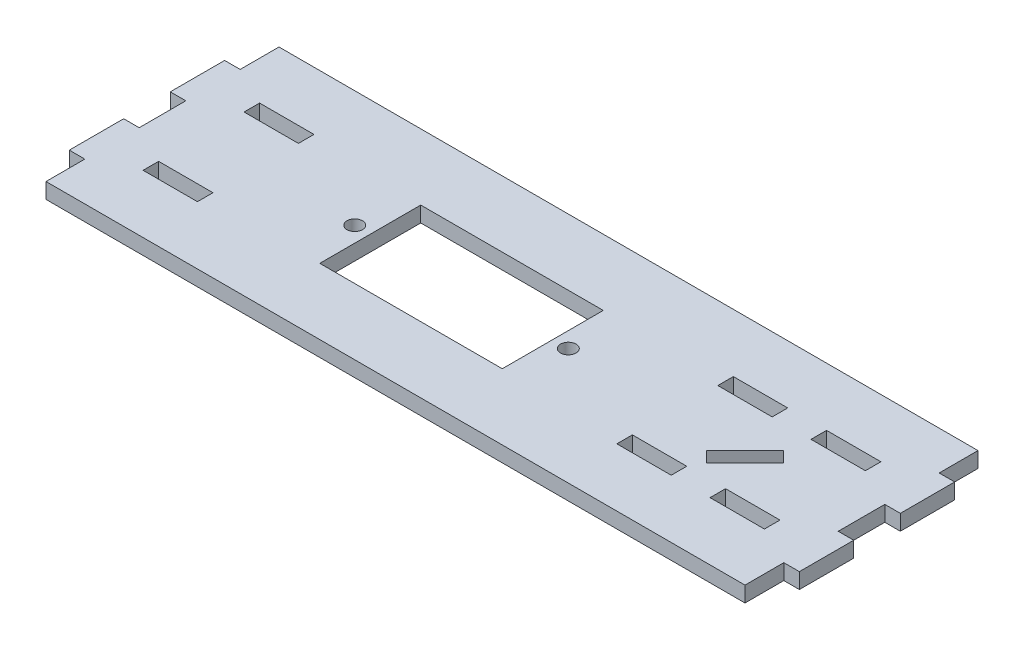
from build123d import *

# Parameters (mm, degrees)
SKETCH1_W           = 7
SKETCH1_H           = 2
SKETCH1_R           = 1
SKETCH1_W_2         = 23.5
SKETCH1_H_2         = 13
BOSS_EXTRUDE1_DEPTH = 2


with BuildPart() as part:
    # Sketch1 → Boss-Extrude1 (new body)
    with BuildSketch(Plane(origin=(0, 0, 0), x_dir=(1, 0, 0), z_dir=(0, 1, 0))):
        Polygon((66.949898611, 13.823848353), (-23.050101389, 13.823848353), (-23.050101389, 8.823848353), (-25.050101389, 8.823848353), (-25.050101389, 1.823848353), (-23.050101389, 1.823848353), (-23.050101389, -4.176151647), (-25.050101389, -4.176151647), (-25.050101389, -11.176151647), (-23.050101389, -11.176151647), (-23.050101389, -16.176151647), (66.949898611, -16.176151647), (66.949898611, -11.176151647), (68.949898611, -11.176151647), (68.949898611, -4.176151647), (66.949898611, -4.176151647), (66.949898611, 1.823848353), (68.949898611, 1.823848353), (68.949898611, 8.823848353), (66.949898611, 8.823848353), align=None)
        with Locations((-14.550101389, -7.676151647)):
            Rectangle(SKETCH1_W, SKETCH1_H, mode=Mode.SUBTRACT)
        with Locations(Location((1.699898611, -1.176151647, 0), (0, 0, 270))):
            Circle(SKETCH1_R, mode=Mode.SUBTRACT)
        with Locations((15.449898611, -1.176151647)):
            Rectangle(SKETCH1_W_2, SKETCH1_H_2, mode=Mode.SUBTRACT)
        with Locations(Location((29.199898611, -1.176151647, 0), (0, 0, 270))):
            Circle(SKETCH1_R, mode=Mode.SUBTRACT)
        with Locations((46.449898611, -7.676151647)):
            Rectangle(SKETCH1_W, SKETCH1_H, mode=Mode.SUBTRACT)
        with Locations((58.449898611, -7.676151647)):
            Rectangle(SKETCH1_W, SKETCH1_H, mode=Mode.SUBTRACT)
        Polygon((55.839898611, -0.11430823), (50.890151142, -5.064055698), (49.47593758, -3.649842135), (54.425685048, 1.299905333), align=None, mode=Mode.SUBTRACT)
        with Locations((-14.550101389, 5.323848353)):
            Rectangle(SKETCH1_W, SKETCH1_H, mode=Mode.SUBTRACT)
        with Locations((46.449898611, 5.323848353)):
            Rectangle(SKETCH1_W, SKETCH1_H, mode=Mode.SUBTRACT)
        with Locations((58.449898611, 5.323848353)):
            Rectangle(SKETCH1_W, SKETCH1_H, mode=Mode.SUBTRACT)
    extrude(amount=BOSS_EXTRUDE1_DEPTH)


solid = part.part
